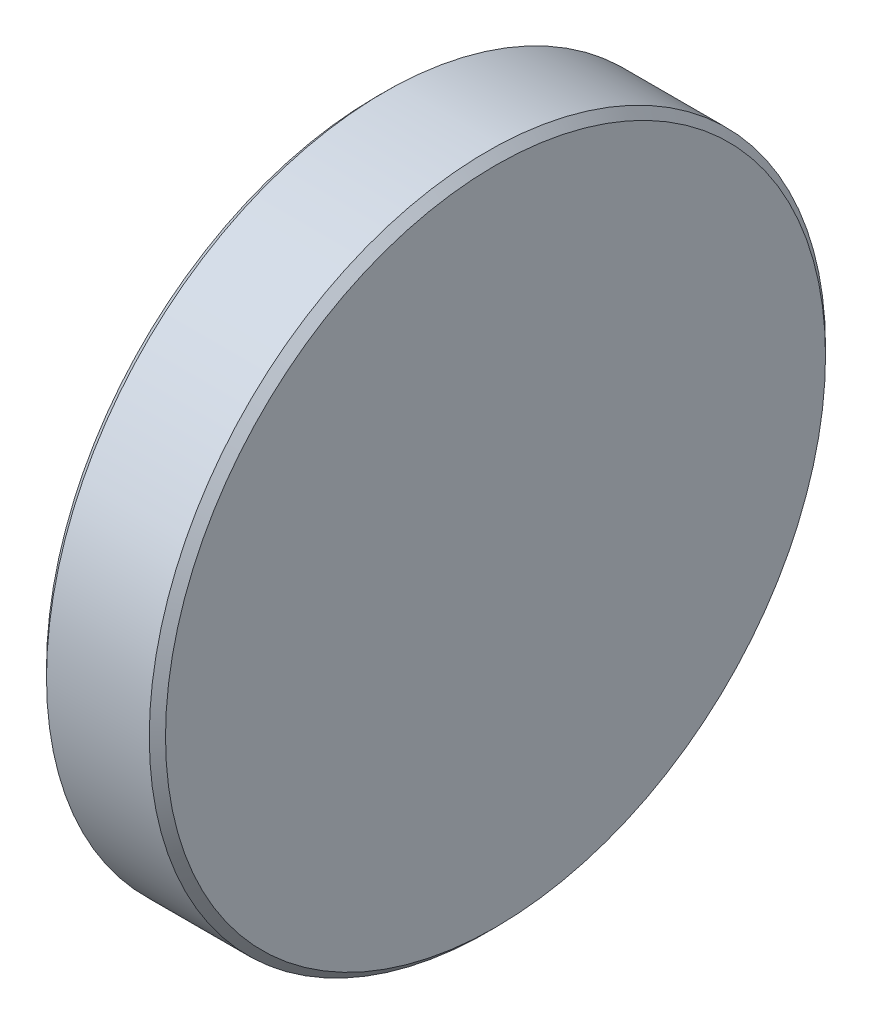
from build123d import *

# Parameters (mm, degrees)
SKETCH1_R           = 63.5
BOSS_EXTRUDE1_DEPTH = 22.352
CHAMFER1_SIZE       = 1.524


with BuildPart() as part:
    # Sketch1 → Boss-Extrude1 (new body)
    with BuildSketch(Plane.YZ):
        with Locations(Location((0, 0, 0), (0, 0, 270))):
            Circle(SKETCH1_R)
    extrude(amount=BOSS_EXTRUDE1_DEPTH)

    # Chamfer1
    chamfer1_edges = [part.edges().sort_by_distance(p)[0] for p in [
        (0, 0, 63.5),
        (22.352, 0, 63.5),
    ]]
    chamfer(chamfer1_edges, length=CHAMFER1_SIZE)


solid = part.part
